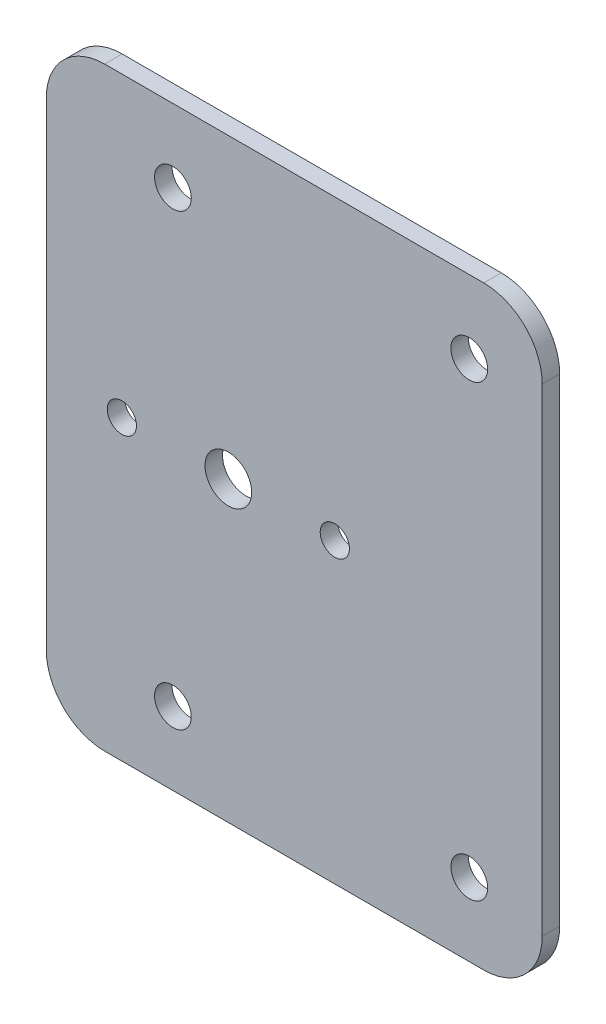
from build123d import *

# Parameters (mm, degrees)
CROQUIS1_W              = 85
CROQUIS1_H              = 102
CROQUIS1_R              = 4
CROQUIS1_R_2            = 2.5
CROQUIS1_R_3            = 3.15
SALIENTE_EXTRUIR1_DEPTH = 3
REDONDEO1_R             = 10


with BuildPart() as part:
    # Croquis1 → Saliente-Extruir1 (new body)
    with BuildSketch(Plane.XY):
        with Locations((11.3, 0)):
            Rectangle(CROQUIS1_W, CROQUIS1_H)
        Circle(CROQUIS1_R, mode=Mode.SUBTRACT)
        with Locations((18.25, 0)):
            Circle(CROQUIS1_R_2, mode=Mode.SUBTRACT)
        with Locations(Location((-18.25, 0, 0), (0, 0, 180))):
            Circle(CROQUIS1_R_2, mode=Mode.SUBTRACT)
        with Locations((-9.5, 38.5)):
            Circle(CROQUIS1_R_3, mode=Mode.SUBTRACT)
        with Locations(Location((-9.5, -38.5, 0), (0, 0, 180))):
            Circle(CROQUIS1_R_3, mode=Mode.SUBTRACT)
        with Locations((41.3, 38.5)):
            Circle(CROQUIS1_R_3, mode=Mode.SUBTRACT)
        with Locations(Location((41.3, -38.5, 0), (0, 0, 180))):
            Circle(CROQUIS1_R_3, mode=Mode.SUBTRACT)
    extrude(amount=SALIENTE_EXTRUIR1_DEPTH)

    # Redondeo1
    redondeo1_edges = [part.edges().sort_by_distance(p)[0] for p in [
        (-31.2, 51, 1.5),
        (53.8, 51, 1.5),
        (53.8, -51, 1.5),
        (-31.2, -51, 1.5),
    ]]
    fillet(redondeo1_edges, radius=REDONDEO1_R)


solid = part.part
